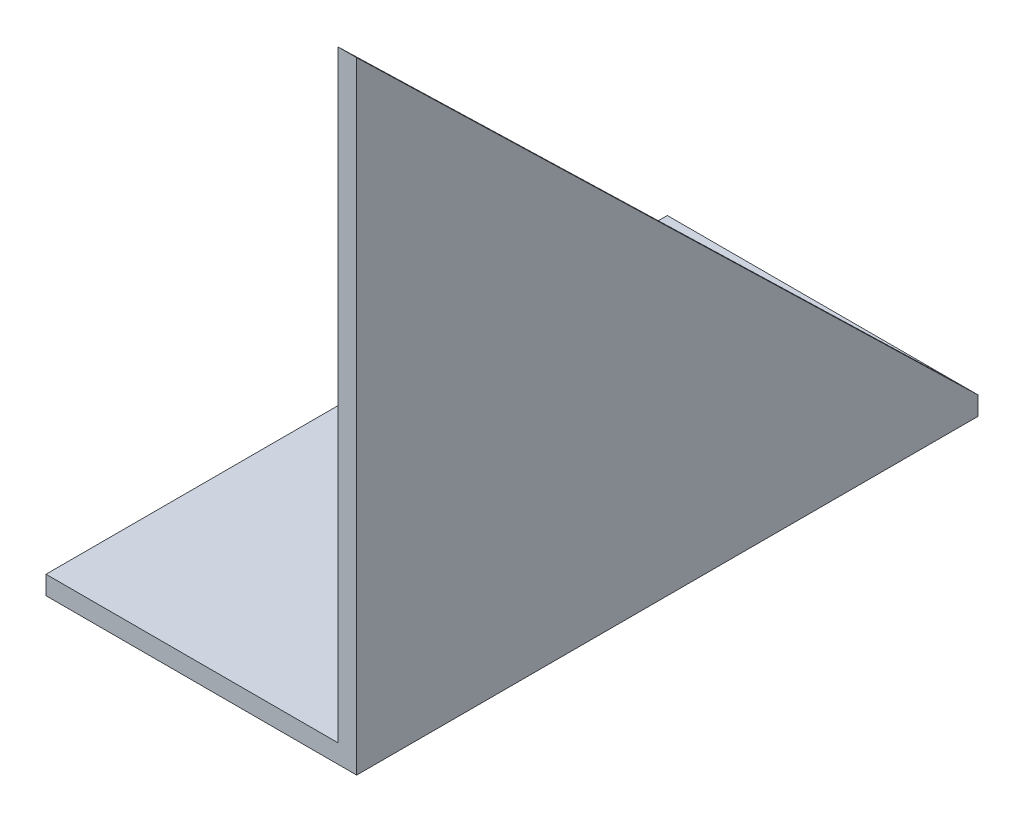
from build123d import *

# Parameters (mm, degrees)
CROQUIS1_W              = 3
CROQUIS1_H              = 100
CROQUIS1_W_2            = 47
CROQUIS1_H_2            = 3
SALIENTE_EXTRUIR1_DEPTH = 50
CORTAR_EXTRUIR2_DEPTH   = 100


with BuildPart() as part:
    # Croquis1 → Saliente-Extruir1 (new, symmetric)
    with BuildSketch(Plane.XY):
        Rectangle(CROQUIS1_W, CROQUIS1_H)
        with Locations((-25, -48.5)):
            Rectangle(CROQUIS1_W_2, CROQUIS1_H_2)
    extrude(amount=SALIENTE_EXTRUIR1_DEPTH, both=True)

    # Croquis3 → Cortar-Extruir2 (cut)
    with BuildSketch(Plane.ZY.offset(1.5)):
        Polygon((50, 50), (-50, -47), (-50, 50), align=None)
    extrude(amount=-CORTAR_EXTRUIR2_DEPTH, mode=Mode.SUBTRACT)


solid = part.part
